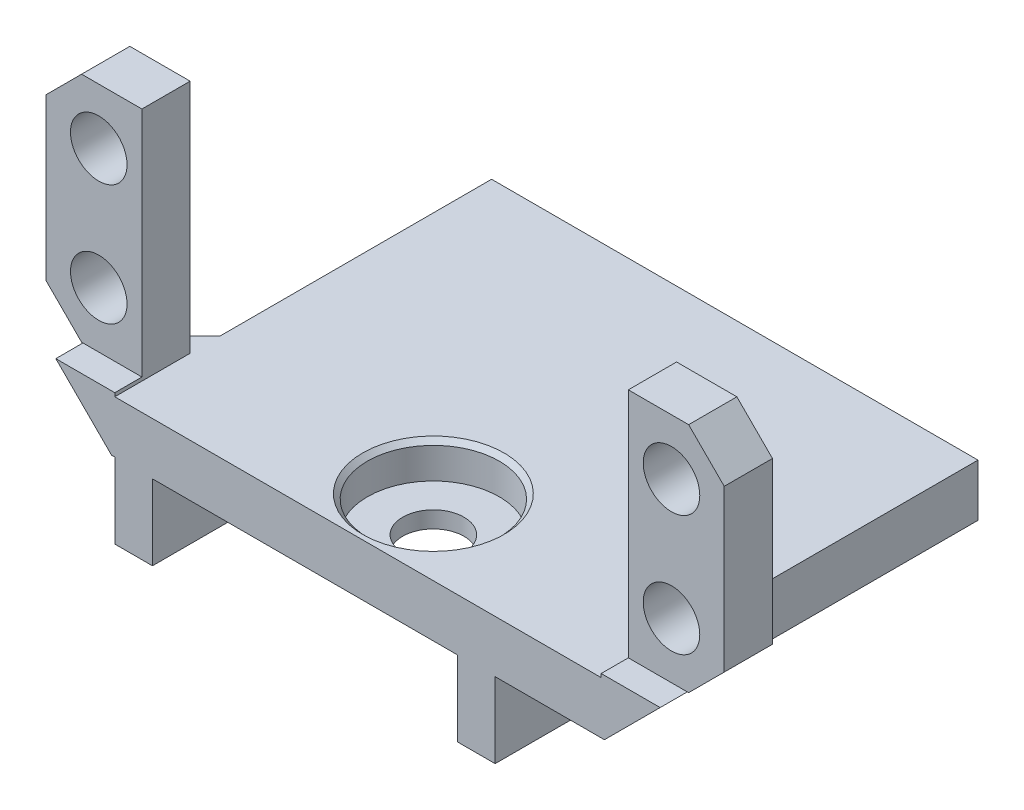
from build123d import *

# Parameters (mm, degrees)
SKETCH1_R               = 3.475
SKETCH1_R_2             = 2.3828
BOSS_EXTRUDE1_DEPTH     = 6.35
CHAMFER1_SIZE           = 3
CHAMFER2_SIZE           = 8
CUT_EXTRUDE1_DEPTH      = 2.286
CUT_EXTRUDE2_DEPTH      = 36.817152344
CUT_EXTRUDE2_DEPTH_BACK = 36.817152344
SKETCH4_W               = 40.986
SKETCH4_H               = 20.158
SKETCH6_W               = 57.000074061
SKETCH6_H               = 19.05
CUT_EXTRUDE3_DEPTH      = 37.147957148
SKETCH9_W               = 40.986
SKETCH9_H               = 4.397387502
BOSS_EXTRUDE2_DEPTH     = 25.4
CHAMFER3_SIZE           = 2.54
SKETCH10_W              = 3.175
SKETCH10_H              = 31.75
BOSS_EXTRUDE3_DEPTH     = 6.35
SKETCH11_R              = 5.55625
CUT_EXTRUDE4_DEPTH      = 3
SKETCH14_R              = 2.58125
CUT_EXTRUDE10_DEPTH     = 6.35
CHAMFER4_SIZE           = 0.4


with BuildPart() as part:
    # Sketch1 → Boss-Extrude1 (new body)
    with BuildSketch(Plane.XY):
        Polygon((17.4625, -21.209), (-17.4625, -21.209), (-17.4625, 1.651), (-28.575, 1.651), (-28.575, 21.209), (28.575, 21.209), (28.575, 1.651), (17.4625, 1.651), align=None)
        with Locations((-9.525, -10.541)):
            Circle(SKETCH1_R, mode=Mode.SUBTRACT)
        with Locations((9.525, -10.541)):
            Circle(SKETCH1_R, mode=Mode.SUBTRACT)
        with Locations((-24.13, 6.35)):
            Circle(SKETCH1_R_2, mode=Mode.SUBTRACT)
        with Locations((-24.13, 16.51)):
            Circle(SKETCH1_R_2, mode=Mode.SUBTRACT)
        with Locations((24.13, 16.51)):
            Circle(SKETCH1_R_2, mode=Mode.SUBTRACT)
        with Locations((24.13, 6.35)):
            Circle(SKETCH1_R_2, mode=Mode.SUBTRACT)
    extrude(amount=BOSS_EXTRUDE1_DEPTH)

    # Chamfer1
    chamfer1_edges = [part.edges().sort_by_distance(p)[0] for p in [
        (-28.575, 1.651, 3.175),
        (-28.575, 21.209, 3.175),
        (28.575, 21.209, 3.175),
        (28.575, 1.651, 3.175),
        (17.4625, -21.209, 3.175),
        (-17.4625, -21.209, 3.175),
    ]]
    chamfer(chamfer1_edges, length=CHAMFER1_SIZE)

    # Chamfer2
    chamfer2_edges = [part.edges().sort_by_distance(p)[0] for p in [
        (17.4625, 1.651, 3.175),
        (-17.4625, 1.651, 3.175),
    ]]
    chamfer(chamfer2_edges, length=CHAMFER2_SIZE)

    # Sketch3 → Cut-Extrude1 (cut)
    with BuildSketch(Plane.XY.offset(6.35)):
        Polygon((-25.4625, 1.651), (25.4625, 1.651), (25.575, 1.651), (28.575, 4.651), (28.575, 18.209), (25.575, 21.209), (-25.575, 21.209), (-28.575, 18.209), (-28.575, 4.651), (-25.575, 1.651), align=None)
    extrude(amount=-CUT_EXTRUDE1_DEPTH, mode=Mode.SUBTRACT)

    # Sketch4 → Cut-Extrude2 (cut, two sides: drawn at the far end of the back side and taken through both)
    with BuildSketch(Plane.XY.offset(4.064).offset(-CUT_EXTRUDE2_DEPTH_BACK)):
        with Locations((0, 11.43)):
            Rectangle(SKETCH4_W, SKETCH4_H)
    extrude(amount=CUT_EXTRUDE2_DEPTH + CUT_EXTRUDE2_DEPTH_BACK, mode=Mode.SUBTRACT)

    # Sketch6 → Cut-Extrude3 (cut, through all)
    with BuildSketch(Plane.XY.offset(6.35)):
        with Locations((-1.923625946, -12.571387502)):
            Rectangle(SKETCH6_W, SKETCH6_H)
    extrude(amount=-CUT_EXTRUDE3_DEPTH, mode=Mode.SUBTRACT)

    # Sketch9 → Boss-Extrude2 (add)
    with BuildSketch(Plane(origin=(0, 0, 0), x_dir=(-1, 0, 0), z_dir=(0, 0, -1))):
        with Locations((0, -0.847693751)):
            Rectangle(SKETCH9_W, SKETCH9_H)
    extrude(amount=BOSS_EXTRUDE2_DEPTH)

    # Chamfer3
    chamfer3_edges = [part.edges().sort_by_distance(p)[0] for p in [
        (-20.493, -0.847693751, 0),
        (20.493, -0.847693751, 0),
    ]]
    chamfer(chamfer3_edges, length=CHAMFER3_SIZE)

    # Sketch10 → Boss-Extrude3 (add)
    with BuildSketch(Plane(origin=(0, -3.046387502, 0), x_dir=(-1, 0, 0), z_dir=(0, -1, 0))):
        with Locations((18.9055, 9.525)):
            Rectangle(SKETCH10_W, SKETCH10_H)
        with Locations((-9.9695, 9.525)):
            Rectangle(SKETCH10_W, SKETCH10_H)
    extrude(amount=BOSS_EXTRUDE3_DEPTH)

    # Sketch11 → Cut-Extrude4 (cut)
    with BuildSketch(Plane(origin=(0, 1.351, 0), x_dir=(1, 0, 0), z_dir=(0, 1, 0))):
        with Locations(Location((0, 0, 0), (0, 0, 180))):
            Circle(SKETCH11_R)
    extrude(amount=-CUT_EXTRUDE4_DEPTH, mode=Mode.SUBTRACT)

    # Sketch14 → Cut-Extrude10 (cut)
    with BuildSketch(Plane(origin=(0, -1.649, 0), x_dir=(1, 0, 0), z_dir=(0, 1, 0))):
        with Locations(Location((0, 0, 0), (0, 0, 180))):
            Circle(SKETCH14_R)
    extrude(amount=-CUT_EXTRUDE10_DEPTH, mode=Mode.SUBTRACT)

    # Chamfer4
    chamfer4_edges = [part.edges().sort_by_distance(p)[0] for p in [
        (5.55625, 1.351, 0),
    ]]
    chamfer(chamfer4_edges, length=CHAMFER4_SIZE)


solid = part.part
